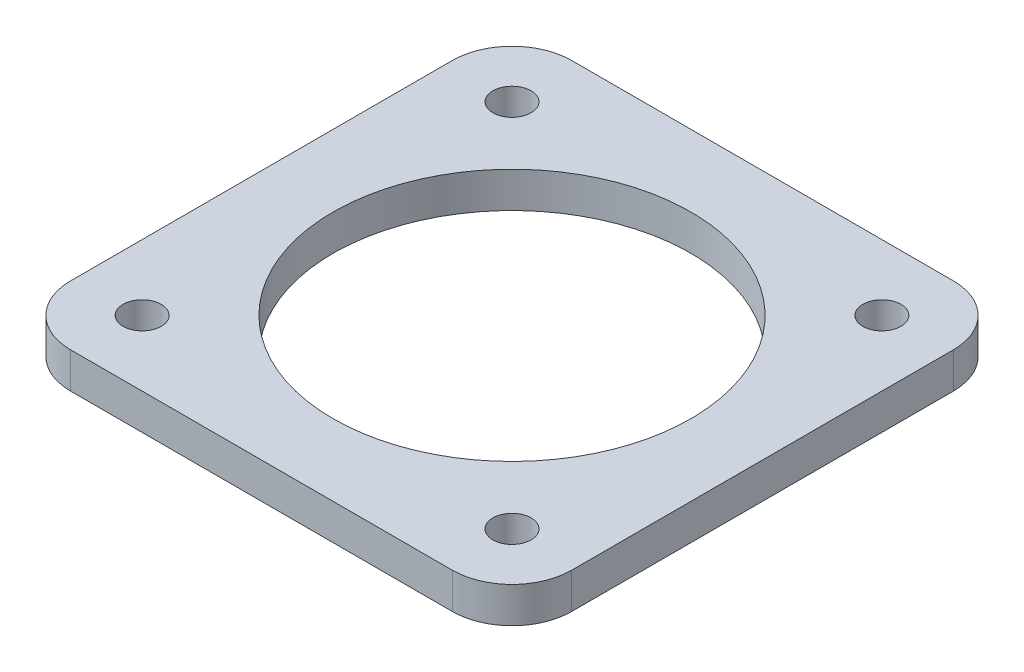
from build123d import *

# Parameters (mm, degrees)
SKETCH_1_W          = 42
SKETCH_1_H          = 42
SKETCH_1_R          = 1.6
SKETCH_1_R_2        = 11
EXTRUDE_1_DEPTH     = 3
SKETCH_2_R          = 15
CUT_EXTRUDE_1_DEPTH = 30.849623113
FILLET_1_R          = 5


with BuildPart() as part:
    # 草图1 → 凸台-拉伸1 (new body)
    with BuildSketch(Plane(origin=(0, 0, 0), x_dir=(1, 0, 0), z_dir=(0, 1, 0))):
        Rectangle(SKETCH_1_W, SKETCH_1_H)
        with Locations(Location((-15.5, 15.5, 0), (0, 0, 270))):
            Circle(SKETCH_1_R, mode=Mode.SUBTRACT)
        with Locations(Location((15.5, 15.5, 0), (0, 0, 270))):
            Circle(SKETCH_1_R, mode=Mode.SUBTRACT)
        with Locations(Location((15.5, -15.5, 0), (0, 0, 270))):
            Circle(SKETCH_1_R, mode=Mode.SUBTRACT)
        with Locations(Location((-15.5, -15.5, 0), (0, 0, 270))):
            Circle(SKETCH_1_R, mode=Mode.SUBTRACT)
        with Locations(Location((0.145011043, -0.145011043, 0), (0, 0, 270))):
            Circle(SKETCH_1_R_2, mode=Mode.SUBTRACT)
    extrude(amount=EXTRUDE_1_DEPTH)

    # 草图2 → 切除-拉伸1 (cut, through all)
    with BuildSketch(Plane(origin=(0, 3, 0), x_dir=(1, 0, 0), z_dir=(0, 1, 0))):
        with Locations(Location((0, 0, 0), (0, 0, 270))):
            Circle(SKETCH_2_R)
    extrude(amount=-CUT_EXTRUDE_1_DEPTH, mode=Mode.SUBTRACT)

    # 圆角1
    fillet_1_edges = [part.edges().sort_by_distance(p)[0] for p in [
        (-21, 1.5, 21),
        (-21, 1.5, -21),
        (21, 1.5, -21),
        (21, 1.5, 21),
    ]]
    fillet(fillet_1_edges, radius=FILLET_1_R)


solid = part.part
